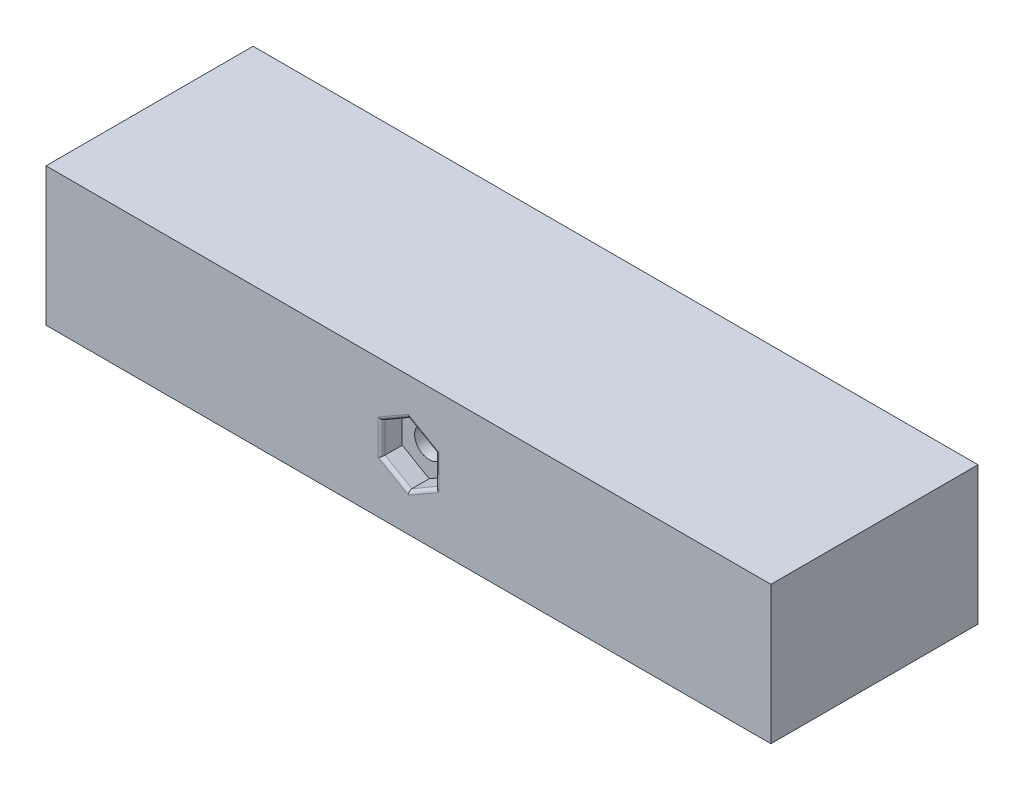
from build123d import *

# Parameters (mm, degrees)
ESQUISSE1_W             = 105
ESQUISSE1_H             = 20
BOSS_EXTRU_1_DEPTH      = 30
ENL_V_MAT_EXTRU_1_DEPTH = 3
CONG_2_R                = 0.5
ESQUISSE8_R             = 2.103774153
ENL_V_MAT_EXTRU_3_DEPTH = 112.018016556
ESQUISSE9_R             = 2
ENL_V_MAT_EXTRU_5_DEPTH = 5
ESQUISSE10_W            = 20
ESQUISSE10_H            = 5
ESQUISSE10_W_2          = 5
ESQUISSE10_H_2          = 15
ENL_V_MAT_EXTRU_6_DEPTH = 8


with BuildPart() as part:
    # Esquisse1 → Boss.-Extru.1 (new body)
    with BuildSketch(Plane.XY):
        with Locations((-52.5, 10)):
            Rectangle(ESQUISSE1_W, ESQUISSE1_H)
    extrude(amount=BOSS_EXTRU_1_DEPTH)

    # Esquisse2 → Enlèv. mat.-Extru.1 (cut)
    with BuildSketch(Plane.XY.offset(30)):
        Polygon((-52.5, 5.4966679), (-48.6, 7.74833395), (-48.6, 12.25166605), (-52.5, 14.5033321), (-56.4, 12.25166605), (-56.4, 7.74833395), align=None)
    extrude(amount=-ENL_V_MAT_EXTRU_1_DEPTH, mode=Mode.SUBTRACT)

    # Congé2
    cong_2_edges = [part.edges().sort_by_distance(p)[0] for p in [
        (-54.45, 6.622500925, 30),
        (-50.55, 6.622500925, 30),
        (-48.6, 10, 30),
        (-50.55, 13.377499075, 30),
        (-54.45, 13.377499075, 30),
        (-56.4, 10, 30),
    ]]
    fillet(cong_2_edges, radius=CONG_2_R)

    # Esquisse8 → Enlèv. mat.-Extru.3 (cut, through all)
    with BuildSketch(Plane.XY):
        with Locations((-52.5, 10)):
            Circle(ESQUISSE8_R)
    extrude(amount=ENL_V_MAT_EXTRU_3_DEPTH, mode=Mode.SUBTRACT)

    # Esquisse9 → Enlèv. mat.-Extru.5 (cut)
    with BuildSketch(Plane.XZ):
        with Locations((-52.5, 20)):
            Circle(ESQUISSE9_R)
    extrude(amount=-ENL_V_MAT_EXTRU_5_DEPTH, mode=Mode.SUBTRACT)

    # Esquisse10 → Enlèv. mat.-Extru.6 (cut)
    with BuildSketch(Plane.XZ):
        with Locations((-15, 7.5)):
            Rectangle(ESQUISSE10_W, ESQUISSE10_H)
        with Locations((-8.89, 20)):
            Rectangle(ESQUISSE10_W_2, ESQUISSE10_H_2)
        with Locations((-96.11, 20)):
            Rectangle(ESQUISSE10_W_2, ESQUISSE10_H_2)
        with Locations((-90, 7.5)):
            Rectangle(ESQUISSE10_W, ESQUISSE10_H)
    extrude(amount=-ENL_V_MAT_EXTRU_6_DEPTH, mode=Mode.SUBTRACT)


solid = part.part
